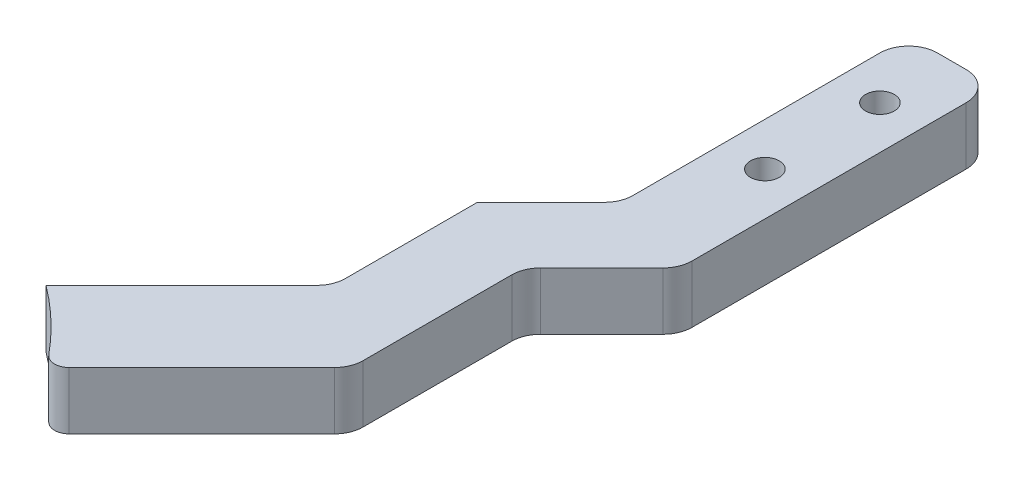
from build123d import *

# Parameters (mm, degrees)
SKETCH_1_R      = 1
EXTRUDE_1_DEPTH = 4
FILLET_1_R      = 2
FILLET_2_R      = 1


with BuildPart() as part:
    # 草图1 → 凸台-拉伸1 (new body)
    with BuildSketch(Plane(origin=(0, 0, 0), x_dir=(1, 0, 0), z_dir=(0, 1, 0))):
        with BuildLine():
            Line((15, 20), (25, 30))
            Line((25, 30), (25, 40))
            Line((25, 40), (30, 45))
            Line((30, 45), (30, 65))
            Line((30, 65), (36, 65))
            Line((36, 65), (36, 43.100505063))
            Line((36, 43.100505063), (30.563454525, 37.663959588))
            Line((30.563454525, 37.663959588), (30.563454525, 25.663959588))
            Line((30.563454525, 25.663959588), (19.956852807, 15.05735787))
            ThreePointArc((19.956852807, 15.05735787), (17.652275132, 17.7030275), (15, 20))
        make_face()
        with Locations(Location((33, 60, 0), (0, 0, 270))):
            Circle(SKETCH_1_R, mode=Mode.SUBTRACT)
        with Locations(Location((33, 52, 0), (0, 0, 270))):
            Circle(SKETCH_1_R, mode=Mode.SUBTRACT)
    extrude(amount=EXTRUDE_1_DEPTH)

    # 圆角1
    fillet_1_edges = [part.edges().sort_by_distance(p)[0] for p in [
        (30, 2, -45),
        (30, 2, -65),
        (36, 2, -65),
        (36, 2, -43.100505063),
        (30.563454525, 2, -37.663959588),
        (30.563454525, 2, -25.663959588),
        (25, 2, -30),
    ]]
    fillet(fillet_1_edges, radius=FILLET_1_R)

    # 圆角2
    fillet_2_edges = [part.edges().sort_by_distance(p)[0] for p in [
        (19.956852807, 2, -15.05735787),
    ]]
    fillet(fillet_2_edges, radius=FILLET_2_R)


solid = part.part
